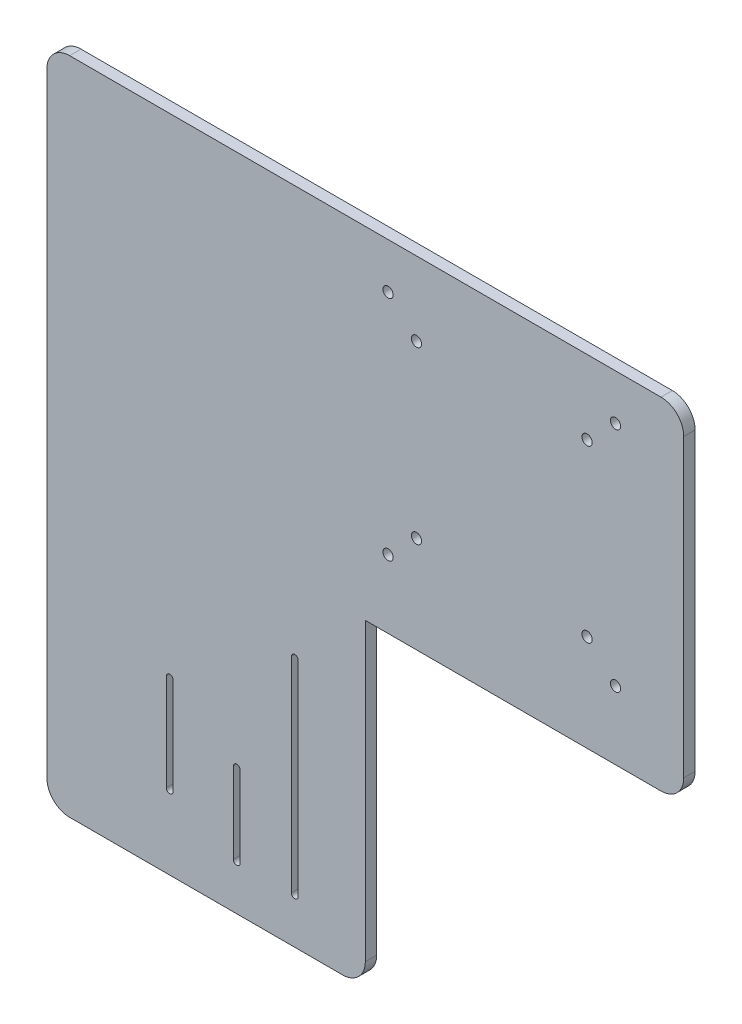
from build123d import *

# Parameters (mm, degrees)
BOSS_EXTRUDE1_DEPTH      = 5
M4_CLEARANCE_HOLE1_D     = 4.5
M4_CLEARANCE_HOLE1_DEPTH = 10
M4_CLEARANCE_HOLE1_TIP   = 1.351936393
CUT_EXTRUDE1_DEPTH       = 404.143894906


with BuildPart() as part:
    # Sketch1 → Boss-Extrude1 (new body)
    with BuildSketch(Plane.XY):
        with BuildLine():
            Line((-10, 0), (-270, 0))
            ThreePointArc((-270, 0), (-277.071067812, -2.928932188), (-280, -10))
            Line((-280, -10), (-280, -280))
            ThreePointArc((-280, -280), (-277.071067812, -287.071067812), (-270, -290))
            Line((-270, -290), (-150, -290))
            ThreePointArc((-150, -290), (-142.928932188, -287.071067812), (-140, -280))
            Line((-140, -280), (-140, -150))
            Line((-140, -150), (-10, -150))
            ThreePointArc((-10, -150), (-2.928932188, -147.071067812), (0, -140))
            Line((0, -140), (0, -10))
            ThreePointArc((0, -10), (-2.928932188, -2.928932188), (-10, 0))
        make_face()
    extrude(amount=BOSS_EXTRUDE1_DEPTH)

    # M4 Clearance Hole1
    with Locations(Plane.XY.offset(5)):
        with Locations((-130, -120), (-30, -120), (-30, -20), (-130, -20), (-117.5, -107.5), (-42.5, -107.5), (-42.5, -32.5), (-117.5, -32.5)):
            Hole(M4_CLEARANCE_HOLE1_D / 2, depth=M4_CLEARANCE_HOLE1_DEPTH)
            with Locations((0, 0, -(M4_CLEARANCE_HOLE1_DEPTH + M4_CLEARANCE_HOLE1_TIP / 2))):  # 118° drill point
                Cone(0, M4_CLEARANCE_HOLE1_D / 2, M4_CLEARANCE_HOLE1_TIP, mode=Mode.SUBTRACT)

    # Sketch4 → Cut-Extrude1 (cut, through all)
    with BuildSketch(Plane.XY.offset(5)):
        with BuildLine():
            Line((-172.5, -270), (-172.5, -180))
            ThreePointArc((-172.5, -180), (-171, -178.5), (-169.5, -180))
            Line((-169.5, -180), (-169.5, -270))
            ThreePointArc((-169.5, -270), (-171, -271.5), (-172.5, -270))
        make_face()
        with BuildLine():
            Line((-198, -270), (-198, -234.5))
            ThreePointArc((-198, -234.5), (-196.5, -233), (-195, -234.5))
            Line((-195, -234.5), (-195, -270))
            ThreePointArc((-195, -270), (-196.5, -271.5), (-198, -270))
        make_face()
        with BuildLine():
            Line((-227.5, -257.5), (-227.5, -215))
            ThreePointArc((-227.5, -215), (-226, -213.5), (-224.5, -215))
            Line((-224.5, -215), (-224.5, -257.5))
            ThreePointArc((-224.5, -257.5), (-226, -259), (-227.5, -257.5))
        make_face()
    extrude(amount=-CUT_EXTRUDE1_DEPTH, mode=Mode.SUBTRACT)


solid = part.part
